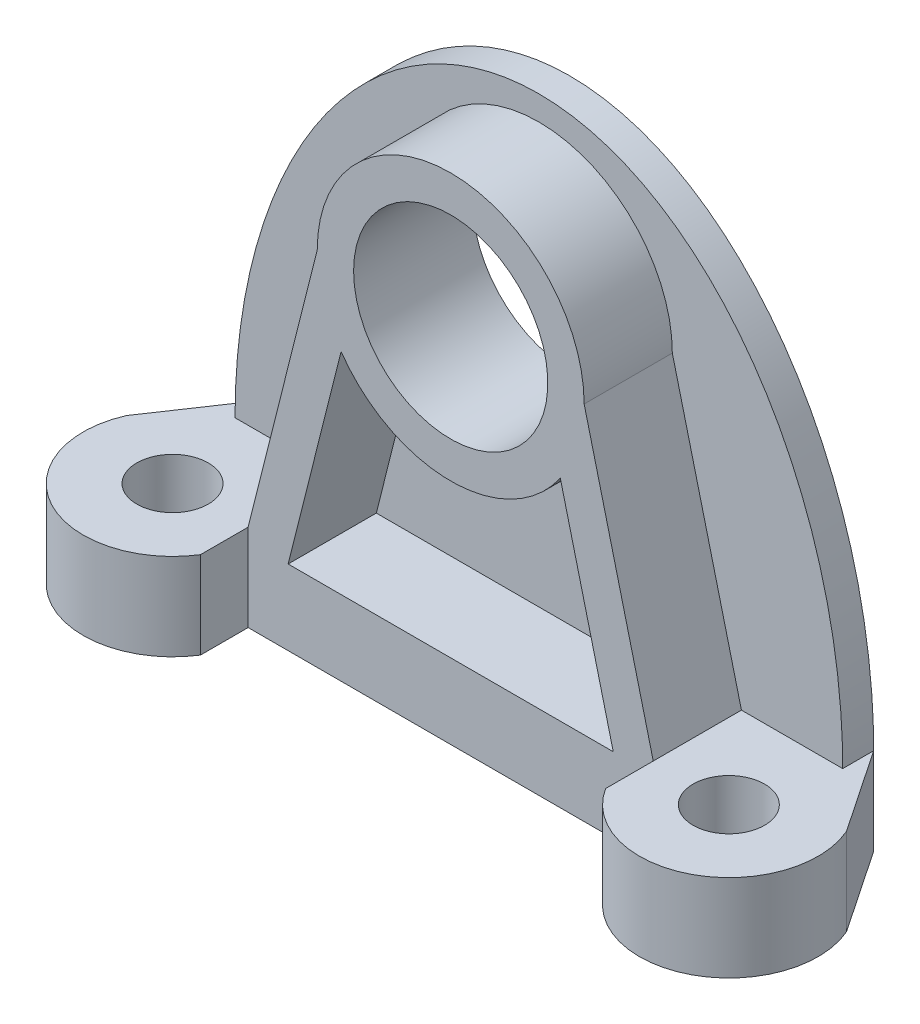
from build123d import *

# Parameters (mm, degrees)
CROQUIS2_R              = 3
SALIENTE_EXTRUIR1_DEPTH = 7.3
CROQUIS3_W              = 34
CROQUIS3_H              = 1
CORTAR_EXTRUIR1_DEPTH   = 7.4
CROQUIS5_R              = 8.15
SALIENTE_EXTRUIR3_DEPTH = 2.6
CROQUIS6_R              = 8.15
SALIENTE_EXTRUIR4_DEPTH = 7.4


with BuildPart() as part:
    # Croquis2 → Saliente-Extruir1 (new body)
    with BuildSketch(Plane(origin=(0, 0, 0), x_dir=(1, 0, 0), z_dir=(0, 1, 0))):
        with BuildLine():
            Line((-25.5, 0), (25.5, 0))
            Line((25.5, 0), (30.218152313, -7))
            ThreePointArc((30.218152313, -7), (26.854290531, -16.627962556), (17, -14))
            Line((17, -14), (17, -10))
            Line((17, -10), (-17, -10))
            Line((-17, -10), (-17, -14))
            ThreePointArc((-17, -14), (-26.854290531, -16.627962556), (-30.218152313, -7))
            Line((-30.218152313, -7), (-25.5, 0))
        make_face()
        with Locations(Location((23.34428877, -10, 0), (0, 0, 270))):
            Circle(CROQUIS2_R, mode=Mode.SUBTRACT)
        with Locations(Location((-23.34428877, -10, 0), (0, 0, 90))):
            Circle(CROQUIS2_R, mode=Mode.SUBTRACT)
    extrude(amount=SALIENTE_EXTRUIR1_DEPTH)

    # Croquis3 → Cortar-Extruir1 (cut)
    with BuildSketch(Plane.XY.offset(10)):
        with Locations((0, 6.8)):
            Rectangle(CROQUIS3_W, CROQUIS3_H)
    extrude(amount=-CORTAR_EXTRUIR1_DEPTH, mode=Mode.SUBTRACT)

    # Croquis5 → Saliente-Extruir3 (add)
    with BuildSketch(Plane(origin=(0, 0, 0), x_dir=(-1, 0, 0), z_dir=(0, 0, -1))):
        with BuildLine():
            Line((-25.5, 7.3), (25.5, 7.3))
            add(Edge.make_bspline(
                [(25.5, 7.3), (25.5, 43.6), (0, 43.6), (-25.5, 43.6), (-25.5, 7.3)],
                knots=[1.570796327, 1.570796327, 1.570796327, 3.141592654, 3.141592654, 4.71238898, 4.71238898, 4.71238898], degree=2, weights=[1, 0.707106781, 1, 0.707106781, 1]))
        make_face()
        with Locations((0, 30.35)):
            Circle(CROQUIS5_R, mode=Mode.SUBTRACT)
    extrude(amount=-SALIENTE_EXTRUIR3_DEPTH)

    # Croquis6 → Saliente-Extruir4 (add)
    with BuildSketch(Plane.XY.offset(2.6)):
        with BuildLine():
            Line((17, 6.3), (17, 7.3))
            Line((17, 7.3), (11.2, 30.35))
            ThreePointArc((11.2, 30.35), (0, 41.55), (-11.2, 30.35))
            Line((-11.2, 30.35), (-17, 7.3))
            Line((-17, 7.3), (-17, 6.3))
            Line((-17, 6.3), (-13.642524215, 6.3))
            Line((-13.642524215, 6.3), (-9.198650155, 23.960568466))
            ThreePointArc((-9.198650155, 23.960568466), (0, 19.15), (9.198650155, 23.960568466))
            Line((9.198650155, 23.960568466), (13.642524215, 6.3))
            Line((13.642524215, 6.3), (17, 6.3))
        make_face()
        with Locations(Location((0, 30.35, 0), (0, 0, 180))):
            Circle(CROQUIS6_R, mode=Mode.SUBTRACT)
    extrude(amount=SALIENTE_EXTRUIR4_DEPTH)


solid = part.part
